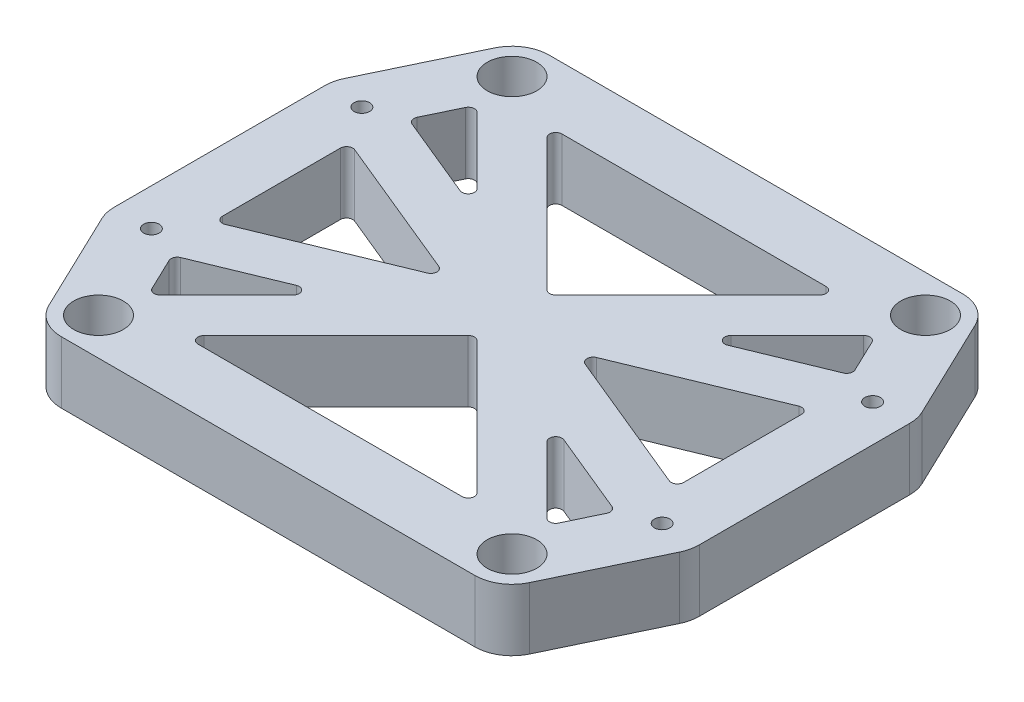
from build123d import *

# Parameters (mm, degrees)
SKETCH1_W               = 130.175
SKETCH1_H               = 110.236
SKETCH1_R               = 1.5875
SKETCH1_R_2             = 5.08
BOSS_EXTRUDE1_DEPTH     = 12.7
CUT_EXTRUDE1_DEPTH      = 87.230311261
CUT_EXTRUDE1_DEPTH_BACK = 87.230311261
SKETCH2_OUTSIDE_W       = 166.385
SKETCH2_OUTSIDE_H       = 146.446


with BuildPart() as part:
    # Sketch1 → Boss-Extrude1 (new body)
    with BuildSketch(Plane(origin=(0, 0, 0), x_dir=(1, 0, 0), z_dir=(0, 1, 0))):
        Rectangle(SKETCH1_W, SKETCH1_H)
        with Locations(Location((-52.3875, 21.59, 0), (0, 0, 270))):
            Circle(SKETCH1_R, mode=Mode.SUBTRACT)
        with Locations(Location((52.3875, 21.59, 0), (0, 0, 270))):
            Circle(SKETCH1_R, mode=Mode.SUBTRACT)
        with Locations(Location((52.3875, -21.59, 0), (0, 0, 270))):
            Circle(SKETCH1_R, mode=Mode.SUBTRACT)
        with Locations(Location((-52.3875, -21.59, 0), (0, 0, 270))):
            Circle(SKETCH1_R, mode=Mode.SUBTRACT)
        with Locations(Location((-42.418, 42.418, 0), (0, 0, 270))):
            Circle(SKETCH1_R_2, mode=Mode.SUBTRACT)
        with Locations(Location((42.418, 42.418, 0), (0, 0, 270))):
            Circle(SKETCH1_R_2, mode=Mode.SUBTRACT)
        with Locations(Location((42.418, -42.418, 0), (0, 0, 270))):
            Circle(SKETCH1_R_2, mode=Mode.SUBTRACT)
        with Locations(Location((-42.418, -42.418, 0), (0, 0, 270))):
            Circle(SKETCH1_R_2, mode=Mode.SUBTRACT)
    extrude(amount=BOSS_EXTRUDE1_DEPTH)

    # Sketch2 outside → Cut-Extrude1 (cut, two sides: drawn at the far end of the back side and taken through both)
    # profile 1 of 9: a face of its own
    with BuildSketch(Plane(origin=(0, 12.7, 0), x_dir=(1, 0, 0), z_dir=(0, 1, 0)).offset(-CUT_EXTRUDE1_DEPTH_BACK)):
        with Locations((-0.0005, 0)):
            Rectangle(SKETCH2_OUTSIDE_W, SKETCH2_OUTSIDE_H)
        with BuildLine():
            Line((42.418, 50.038), (-42.418, 50.038))
            ThreePointArc((-42.418, 50.038), (-46.479726634, 48.865230161), (-49.291198546, 45.707915158))
            Line((-49.291198546, 45.707915158), (-59.260698546, 24.879915158))
            ThreePointArc((-59.260698546, 24.879915158), (-59.818454613, 23.276805721), (-60.0075, 21.59))
            Line((-60.0075, 21.59), (-60.0075, -21.59))
            ThreePointArc((-60.0075, -21.59), (-59.818454613, -23.276805721), (-59.260698546, -24.879915158))
            Line((-59.260698546, -24.879915158), (-49.291198546, -45.707915158))
            ThreePointArc((-49.291198546, -45.707915158), (-46.479726634, -48.865230161), (-42.418, -50.038))
            Line((-42.418, -50.038), (42.418, -50.038))
            ThreePointArc((42.418, -50.038), (46.479726634, -48.865230161), (49.291198546, -45.707915158))
            Line((49.291198546, -45.707915158), (59.260698546, -24.879915158))
            ThreePointArc((59.260698546, -24.879915158), (59.818454613, -23.276805721), (60.0075, -21.59))
            Line((60.0075, -21.59), (60.0075, 21.59))
            ThreePointArc((60.0075, 21.59), (59.818454613, 23.276805721), (59.260698546, 24.879915158))
            Line((59.260698546, 24.879915158), (49.291198546, 45.707915158))
            ThreePointArc((49.291198546, 45.707915158), (46.479726634, 48.865230161), (42.418, 50.038))
        make_face(mode=Mode.SUBTRACT)
    # profile 2 of 9: a face of its own
    with BuildSketch(Plane(origin=(0, 12.7, 0), x_dir=(1, 0, 0), z_dir=(0, 1, 0)).offset(-CUT_EXTRUDE1_DEPTH_BACK)):
        with BuildLine():
            Line((-27.087743879, -37.338), (27.087743879, -37.338))
            ThreePointArc((27.087743879, -37.338), (28.261070885, -36.554007959), (27.985769491, -35.169974388))
            Line((27.985769491, -35.169974388), (0.898025612, -8.082230509))
            ThreePointArc((0.898025612, -8.082230509), (0, -7.710256121), (-0.898025612, -8.082230509))
            Line((-0.898025612, -8.082230509), (-27.985769491, -35.169974388))
            ThreePointArc((-27.985769491, -35.169974388), (-28.261070885, -36.554007959), (-27.087743879, -37.338))
        make_face()
    # profile 3 of 9: a face of its own
    with BuildSketch(Plane(origin=(0, 12.7, 0), x_dir=(1, 0, 0), z_dir=(0, 1, 0)).offset(-CUT_EXTRUDE1_DEPTH_BACK)):
        with BuildLine():
            Line((-44.245555664, -23.729025589), (-27.442482896, -16.804122872))
            ThreePointArc((-27.442482896, -16.804122872), (-25.901976239, -17.273686348), (-26.060547132, -18.876342235))
            Line((-26.060547132, -18.876342235), (-39.665944234, -32.481739337))
            ThreePointArc((-39.665944234, -32.481739337), (-40.778186169, -32.835516971), (-41.709502937, -32.132032918))
            Line((-41.709502937, -32.132032918), (-44.907178603, -25.451538533))
            ThreePointArc((-44.907178603, -25.451538533), (-44.947197717, -24.447844803), (-44.245555664, -23.729025589))
        make_face()
    # profile 4 of 9: a face of its own
    with BuildSketch(Plane(origin=(0, 12.7, 0), x_dir=(1, 0, 0), z_dir=(0, 1, 0)).offset(-CUT_EXTRUDE1_DEPTH_BACK)):
        with BuildLine():
            Line((-45.553589848, -13.279107107), (-16.181373616, -1.174193751))
            ThreePointArc((-16.181373616, -1.174193751), (-15.395283768, 0), (-16.181373616, 1.174193751))
            Line((-16.181373616, 1.174193751), (-45.553589848, 13.279107107))
            ThreePointArc((-45.553589848, 13.279107107), (-46.744017554, 13.160248823), (-47.3075, 12.104913356))
            Line((-47.3075, 12.104913356), (-47.3075, -12.104913356))
            ThreePointArc((-47.3075, -12.104913356), (-46.744017554, -13.160248823), (-45.553589848, -13.279107107))
        make_face()
    # profile 5 of 9: a face of its own
    with BuildSketch(Plane(origin=(0, 12.7, 0), x_dir=(1, 0, 0), z_dir=(0, 1, 0)).offset(-CUT_EXTRUDE1_DEPTH_BACK)):
        with BuildLine():
            Line((-44.245555664, 23.729025589), (-27.442482896, 16.804122872))
            ThreePointArc((-27.442482896, 16.804122872), (-25.901976239, 17.273686348), (-26.060547132, 18.876342235))
            Line((-26.060547132, 18.876342235), (-39.665944234, 32.481739337))
            ThreePointArc((-39.665944234, 32.481739337), (-40.778186169, 32.835516971), (-41.709502937, 32.132032918))
            Line((-41.709502937, 32.132032918), (-44.907178603, 25.451538533))
            ThreePointArc((-44.907178603, 25.451538533), (-44.947197717, 24.447844803), (-44.245555664, 23.729025589))
        make_face()
    # profile 6 of 9: a face of its own
    with BuildSketch(Plane(origin=(0, 12.7, 0), x_dir=(1, 0, 0), z_dir=(0, 1, 0)).offset(-CUT_EXTRUDE1_DEPTH_BACK)):
        with BuildLine():
            Line((0.898025612, 8.082230509), (27.985769491, 35.169974388))
            ThreePointArc((27.985769491, 35.169974388), (28.261070885, 36.554007959), (27.087743879, 37.338))
            Line((27.087743879, 37.338), (-27.087743879, 37.338))
            ThreePointArc((-27.087743879, 37.338), (-28.261070885, 36.554007959), (-27.985769491, 35.169974388))
            Line((-27.985769491, 35.169974388), (-0.898025612, 8.082230509))
            ThreePointArc((-0.898025612, 8.082230509), (0, 7.710256121), (0.898025612, 8.082230509))
        make_face()
    # profile 7 of 9: a face of its own
    with BuildSketch(Plane(origin=(0, 12.7, 0), x_dir=(1, 0, 0), z_dir=(0, 1, 0)).offset(-CUT_EXTRUDE1_DEPTH_BACK)):
        with BuildLine():
            Line((27.442482896, 16.804122872), (44.245555664, 23.729025589))
            ThreePointArc((44.245555664, 23.729025589), (44.947197717, 24.447844803), (44.907178603, 25.451538533))
            Line((44.907178603, 25.451538533), (41.709502937, 32.132032918))
            ThreePointArc((41.709502937, 32.132032918), (40.778186169, 32.835516971), (39.665944234, 32.481739337))
            Line((39.665944234, 32.481739337), (26.060547132, 18.876342235))
            ThreePointArc((26.060547132, 18.876342235), (25.901976239, 17.273686348), (27.442482896, 16.804122872))
        make_face()
    # profile 8 of 9: a face of its own
    with BuildSketch(Plane(origin=(0, 12.7, 0), x_dir=(1, 0, 0), z_dir=(0, 1, 0)).offset(-CUT_EXTRUDE1_DEPTH_BACK)):
        with BuildLine():
            Line((16.181373616, 1.174193751), (45.553589848, 13.279107107))
            ThreePointArc((45.553589848, 13.279107107), (46.744017554, 13.160248823), (47.3075, 12.104913356))
            Line((47.3075, 12.104913356), (47.3075, -12.104913356))
            ThreePointArc((47.3075, -12.104913356), (46.744017554, -13.160248823), (45.553589848, -13.279107107))
            Line((45.553589848, -13.279107107), (16.181373616, -1.174193751))
            ThreePointArc((16.181373616, -1.174193751), (15.395283768, 0), (16.181373616, 1.174193751))
        make_face()
    # profile 9 of 9: a face of its own
    with BuildSketch(Plane(origin=(0, 12.7, 0), x_dir=(1, 0, 0), z_dir=(0, 1, 0)).offset(-CUT_EXTRUDE1_DEPTH_BACK)):
        with BuildLine():
            Line((26.060547132, -18.876342235), (39.665944234, -32.481739337))
            ThreePointArc((39.665944234, -32.481739337), (40.778186169, -32.835516971), (41.709502937, -32.132032918))
            Line((41.709502937, -32.132032918), (44.907178603, -25.451538533))
            ThreePointArc((44.907178603, -25.451538533), (44.947197717, -24.447844803), (44.245555664, -23.729025589))
            Line((44.245555664, -23.729025589), (27.442482896, -16.804122872))
            ThreePointArc((27.442482896, -16.804122872), (25.901976239, -17.273686348), (26.060547132, -18.876342235))
        make_face()
    extrude(amount=CUT_EXTRUDE1_DEPTH + CUT_EXTRUDE1_DEPTH_BACK, mode=Mode.SUBTRACT)


solid = part.part
